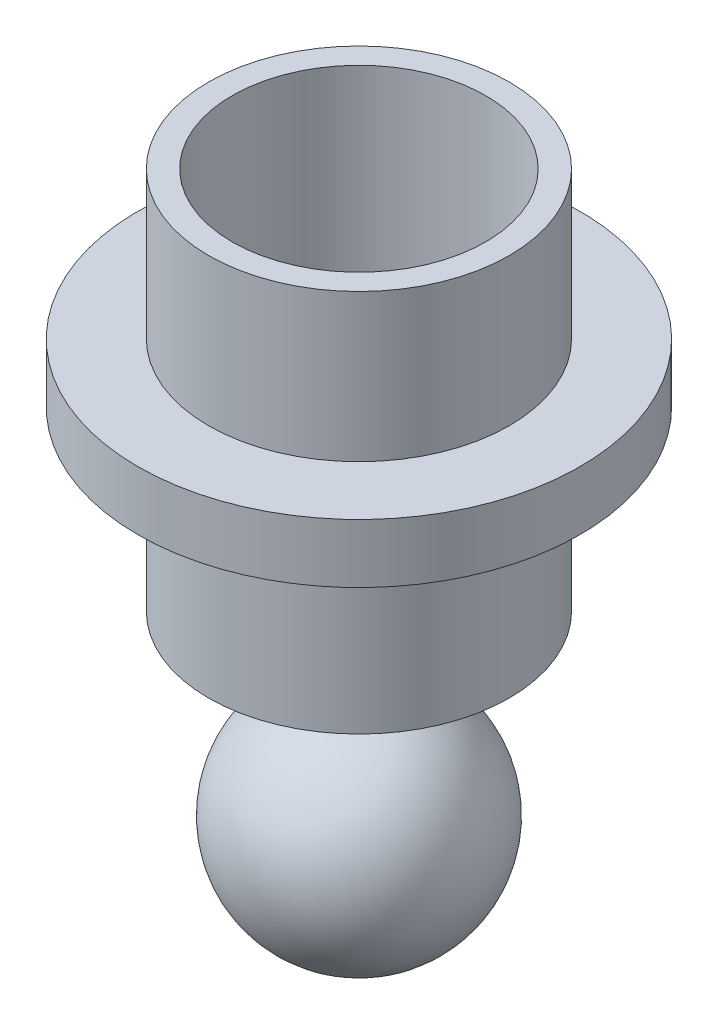
from build123d import *
from build123d.topology import SkipClean

# Parameters (mm, degrees)
SKETCH2_R           = 5.1
BOSS_EXTRUDE1_DEPTH = 1
SKETCH3_R           = 5.1
SKETCH3_R_2         = 4.3
BOSS_EXTRUDE2_DEPTH = 12
CUT_EXTRUDE2_DEPTH  = 1
SKETCH7_R           = 7.5
SKETCH7_R_2         = 5.1
BOSS_EXTRUDE4_DEPTH = 2


with BuildPart() as part:
    # Sketch2 → Boss-Extrude1 (new body)
    with BuildSketch(Plane(origin=(0, 0, 0), x_dir=(1, 0, 0), z_dir=(0, 1, 0))):
        with Locations(Location((0, 0, 0), (0, 0, 270))):
            Circle(SKETCH2_R)
    extrude(amount=BOSS_EXTRUDE1_DEPTH)

    # Sketch3 → Boss-Extrude2 (add)
    with BuildSketch(Plane(origin=(0, 1, 0), x_dir=(1, 0, 0), z_dir=(0, 1, 0))):
        with Locations(Location((0, 0, 0), (0, 0, 270))):
            Circle(SKETCH3_R)
        with Locations(Location((0, 0, 0), (0, 0, 270))):
            Circle(SKETCH3_R_2, mode=Mode.SUBTRACT)
    extrude(amount=BOSS_EXTRUDE2_DEPTH)

    # Sketch6 → Cut-Extrude2 (cut)
    with BuildSketch(Plane(origin=(0, 1, 0), x_dir=(1, 0, 0), z_dir=(0, 1, 0))):
        with BuildLine():
            ThreePointArc((-1.767766953, 1.767766953), (-2.165063509, 1.25), (-2.414814566, 0.647047613))
            Line((-2.414814566, 0.647047613), (-3.187555227, 0.854102849))
            ThreePointArc((-3.187555227, 0.854102849), (-2.857883832, 1.65), (-2.333452378, 2.333452378))
            Line((-2.333452378, 2.333452378), (-1.767766953, 1.767766953))
        make_face()
        with BuildLine():
            ThreePointArc((2.414814566, 0.647047613), (2.165063509, 1.25), (1.767766953, 1.767766953))
            Line((1.767766953, 1.767766953), (2.333452378, 2.333452378))
            ThreePointArc((2.333452378, 2.333452378), (2.857883832, 1.65), (3.187555227, 0.854102849))
            Line((3.187555227, 0.854102849), (2.414814566, 0.647047613))
        make_face()
        with BuildLine():
            ThreePointArc((1.767766953, -1.767766953), (2.165063509, -1.25), (2.414814566, -0.647047613))
            Line((2.414814566, -0.647047613), (3.187555227, -0.854102849))
            ThreePointArc((3.187555227, -0.854102849), (2.857883832, -1.65), (2.333452378, -2.333452378))
            Line((2.333452378, -2.333452378), (1.767766953, -1.767766953))
        make_face()
        with BuildLine():
            ThreePointArc((-0.647047613, -2.414814566), (0, -2.5), (0.647047613, -2.414814566))
            Line((0.647047613, -2.414814566), (0.854102849, -3.187555227))
            ThreePointArc((0.854102849, -3.187555227), (0, -3.3), (-0.854102849, -3.187555227))
            Line((-0.854102849, -3.187555227), (-0.647047613, -2.414814566))
        make_face()
        with BuildLine():
            ThreePointArc((-2.414814566, -0.647047613), (-2.165063509, -1.25), (-1.767766953, -1.767766953))
            Line((-1.767766953, -1.767766953), (-2.333452378, -2.333452378))
            ThreePointArc((-2.333452378, -2.333452378), (-2.857883832, -1.65), (-3.187555227, -0.854102849))
            Line((-3.187555227, -0.854102849), (-2.414814566, -0.647047613))
        make_face()
        with BuildLine():
            ThreePointArc((0.647047613, 2.414814566), (0, 2.5), (-0.647047613, 2.414814566))
            Line((-0.647047613, 2.414814566), (-0.854102849, 3.187555227))
            ThreePointArc((-0.854102849, 3.187555227), (0, 3.3), (0.854102849, 3.187555227))
            Line((0.854102849, 3.187555227), (0.647047613, 2.414814566))
        make_face()
    extrude(amount=-CUT_EXTRUDE2_DEPTH, mode=Mode.SUBTRACT)

    # Sketch7 → Boss-Extrude4 (add)
    with BuildSketch(Plane(origin=(0, 6, 0), x_dir=(1, 0, 0), z_dir=(0, 1, 0))):
        with Locations(Location((0, 0, 0), (0, 0, 270))):
            Circle(SKETCH7_R)
        with Locations(Location((0, 0, 0), (0, 0, 270))):
            Circle(SKETCH7_R_2, mode=Mode.SUBTRACT)
    extrude(amount=BOSS_EXTRUDE4_DEPTH)

    # Sketch10 → Revolve1 (revolve)
    with SkipClean():  # the faces are left unmerged after this step: merging them gives an invalid solid
        with BuildSketch(Plane(origin=(0, 0, 0), x_dir=(0, 0, -1), z_dir=(1, 0, 0)), mode=Mode.PRIVATE) as revolve1_sk:
            with BuildLine():
                ThreePointArc((1.5, -2.4), (0.764852927, -2.175735365), (0, -2.1))
                Line((0, -2.1), (0, -6))
                Line((0, -6), (0, -9.9))
                ThreePointArc((0, -9.9), (2.757716447, -8.757716447), (3.9, -6))
                ThreePointArc((3.9, -6), (3.244996148, -3.836669235), (1.5, -2.4))
            make_face()
            with BuildLine():
                Line((0, -6), (0, -2.1))
                ThreePointArc((0, -2.1), (-0.764852927, -2.175735365), (-1.5, -2.4))
                ThreePointArc((-1.5, -2.4), (-3.824264635, -6.764852927), (0, -9.9))
                Line((0, -9.9), (0, -6))
            make_face()
            with BuildLine():
                Line((0, -2.1), (0, 0))
                Line((0, 0), (-1.5, 0))
                Line((-1.5, 0), (-1.5, -2.4))
                ThreePointArc((-1.5, -2.4), (-0.764852927, -2.175735365), (0, -2.1))
            make_face()
        revolve(revolve1_sk.sketch.rotate(Axis((0, -2.1, 0), (0, -1, 0)), 180), axis=Axis((0, -2.1, 0), (0, -1, 0)))


solid = part.part
